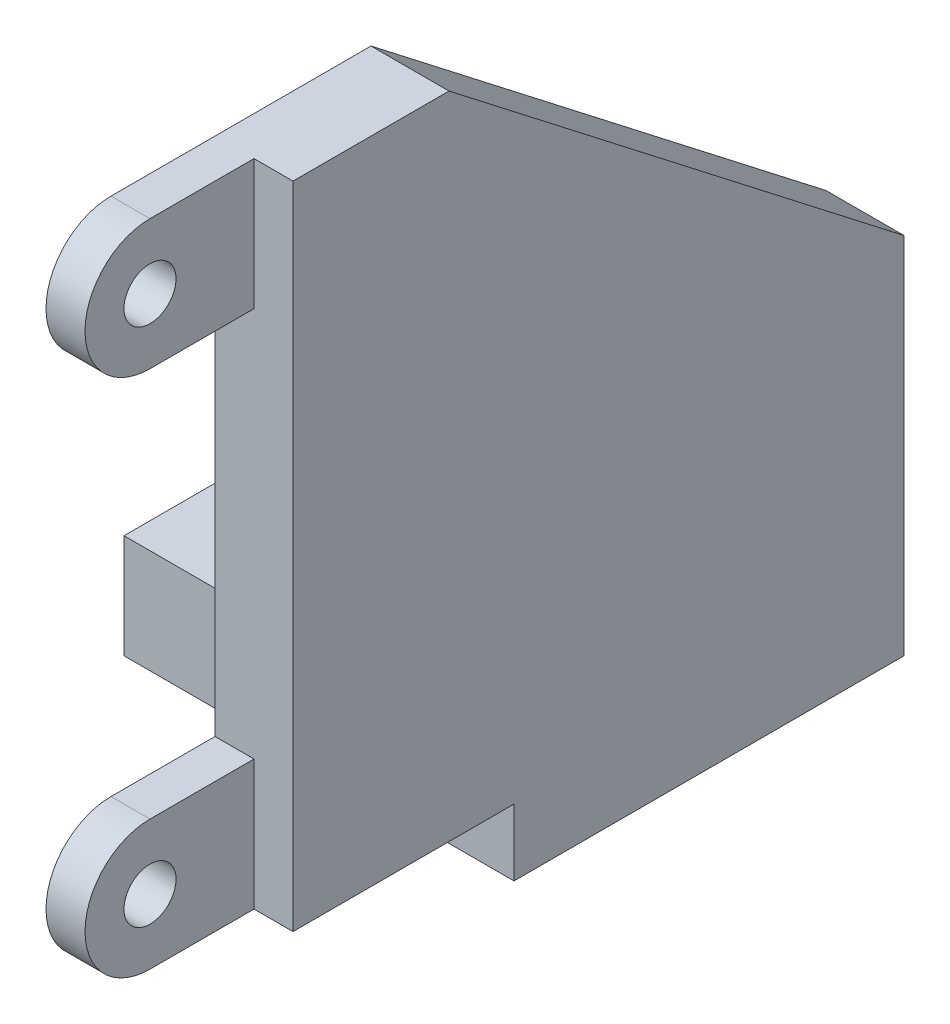
from build123d import *

# Parameters (mm, degrees)
SKETCH_1_W          = 30
SKETCH_1_H          = 30
SKETCH_1_R          = 2
EXTRUDE_1_DEPTH     = 8
SKETCH_3_R          = 2
EXTRUDE_2_DEPTH     = 6
CHAMFER_1_SIZE      = 3
CUT_EXTRUDE_START   = -6
SKETCH_4_W          = 13
SKETCH_4_H          = 50
CUT_EXTRUDE_1_DEPTH = 3


with BuildPart() as part:
    # 草图1 → 凸台-拉伸1 (new body)
    with BuildSketch(Plane(origin=(0, 0, 0), x_dir=(1, 0, 0), z_dir=(0, 1, 0))):
        with Locations((-15, 0)):
            Rectangle(SKETCH_1_W, SKETCH_1_H)
        with Locations(Location((-17, 7.5, 0), (0, 0, 90))):
            Circle(SKETCH_1_R, mode=Mode.SUBTRACT)
        with Locations(Location((-17, -7.5, 0), (0, 0, 270))):
            Circle(SKETCH_1_R, mode=Mode.SUBTRACT)
    extrude(amount=EXTRUDE_1_DEPTH)

    # 草图3 → 凸台-拉伸2 (add)
    with BuildSketch(Plane(origin=(0, 0, 0), x_dir=(0, 0, -1), z_dir=(1, 0, 0))):
        with BuildLine():
            Line((-15, 8), (-15, 5.125))
            Line((-15, 5.125), (-40, 5.125))
            ThreePointArc((-40, 5.125), (-45, 10.125), (-40, 15.125))
            Line((-40, 15.125), (-32, 15.125))
            Line((-32, 15.125), (-32, 45.125))
            Line((-32, 45.125), (-40, 45.125))
            ThreePointArc((-40, 45.125), (-45, 50.125), (-40, 55.125))
            Line((-40, 55.125), (-20, 55.125))
            Line((-20, 55.125), (15, 28))
            Line((15, 28), (15, 8))
            Line((15, 8), (-15, 8))
        make_face()
        with Locations((-40, 10.125)):
            Circle(SKETCH_3_R, mode=Mode.SUBTRACT)
        with Locations((-40, 50.125)):
            Circle(SKETCH_3_R, mode=Mode.SUBTRACT)
    extrude(amount=-EXTRUDE_2_DEPTH)

    # 倒角1
    chamfer_1_edges = [part.edges().sort_by_distance(p)[0] for p in [
        (-17, 8, -5.5),
        (-17, 8, 5.5),
    ]]
    chamfer(chamfer_1_edges, length=CHAMFER_1_SIZE)

    # 草图4 → 切除-拉伸1 (cut)
    with BuildSketch(Plane.ZY.offset(6).offset(CUT_EXTRUDE_START)):
        with Locations((38.5, 30.125)):
            Rectangle(SKETCH_4_W, SKETCH_4_H)
    extrude(amount=CUT_EXTRUDE_1_DEPTH, mode=Mode.SUBTRACT)


solid = part.part
